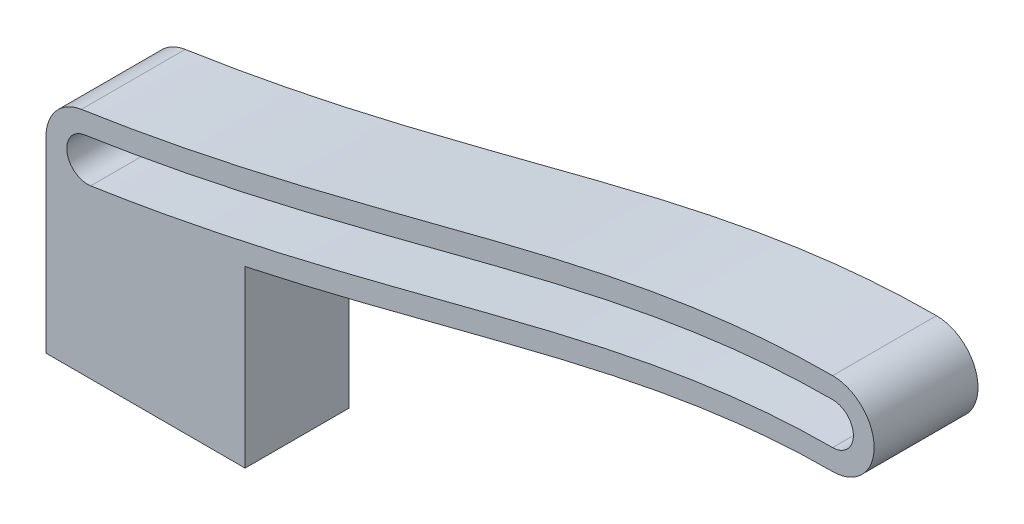
from build123d import *

# Parameters (mm, degrees)
BOSS_EXTRUDE1_DEPTH = 5
BOSS_EXTRUDE2_DEPTH = 5


with BuildPart() as part:
    # Sketch1 → Boss-Extrude1 (new body)
    with BuildSketch(Plane.XY):
        with BuildLine():
            add(Edge.make_bspline(
                [(28.284271497, 14), (26.832248759, 13.999999819), (23.942322546, 13.818389143), (18.107055454, 12.906300241), (10.807723253, 11.057558996), (1.886546527, 8.727754338), (-4.221907722, 7.524457078), (-7.287402613, 7.062387403)],
                knots=[0, 0, 0, 0, 0.085588552, 0.171177105, 0.342354209, 0.513531314, 0.684708419, 0.684708419, 0.684708419, 0.684708419], degree=3))
            ThreePointArc((-7.287402613, 7.062387403), (-9.563159868, 8.741949524), (-7.883597747, 11.017706779))
            add(Edge.make_bspline(
                [(28.284270998, 18), (26.686938926, 17.999999801), (23.476167151, 17.798108662), (17.246191739, 16.817667516), (9.748762966, 14.913893444), (0.95977161, 12.622104017), (-4.916957068, 11.464875912), (-7.883597747, 11.017706779)],
                knots=[0, 0, 0, 0, 0.085588552, 0.171177105, 0.342354209, 0.513531314, 0.684708419, 0.684708419, 0.684708419, 0.684708419], degree=3))
            ThreePointArc((28.284270998, 18), (30.284271247, 16.00000025), (28.284271497, 14))
        make_face()
        with BuildLine():
            ThreePointArc((28.284271123, 17), (29.284271247, 16.000000125), (28.284271372, 15))
            add(Edge.make_bspline(
                [(28.284271372, 15), (25.299991519, 14.999999628), (19.368041064, 14.256121216), (10.541251955, 12.021782806), (1.655347435, 9.701301701), (-4.395670061, 8.509561786), (-7.436451397, 8.051217247)],
                knots=[0, 0, 0, 0, 0.171177105, 0.342354209, 0.513531314, 0.684708419, 0.684708419, 0.684708419, 0.684708419], degree=3))
            ThreePointArc((-7.436451397, 8.051217247), (-8.574330024, 8.890998308), (-7.734548963, 10.028876935))
            add(Edge.make_bspline(
                [(28.284271123, 17), (26.723266395, 16.999999805), (23.592705995, 16.803178782), (17.46140767, 15.839825697), (10.013503037, 13.949809832), (1.19146534, 11.648516598), (-4.743194733, 10.479771203), (-7.734548963, 10.028876935)],
                knots=[0, 0, 0, 0, 0.085588552, 0.171177105, 0.342354209, 0.513531314, 0.684708419, 0.684708419, 0.684708419, 0.684708419], degree=3))
        make_face(mode=Mode.SUBTRACT)
    extrude(amount=BOSS_EXTRUDE1_DEPTH)

    # Sketch2 → Boss-Extrude2 (add)
    with BuildSketch(Plane.XY):
        with BuildLine():
            Line((-9.58550018, 0), (0, 0))
            Line((0, 0), (0, 8.405502806))
            add(Edge.make_bspline(
                [(0, 8.405502806), (-2.412231278, 7.886824896), (-4.846244229, 7.430349282), (-7.287402613, 7.062387403)],
                knots=[0.548394238, 0.548394238, 0.548394238, 0.548394238, 0.684708419, 0.684708419, 0.684708419, 0.684708419], degree=3))
            ThreePointArc((-7.287402613, 7.062387403), (-8.890070007, 7.524099346), (-9.58550018, 9.040047091))
            Line((-9.58550018, 9.040047091), (-9.58550018, 0))
        make_face()
    extrude(amount=BOSS_EXTRUDE2_DEPTH)


solid = part.part
